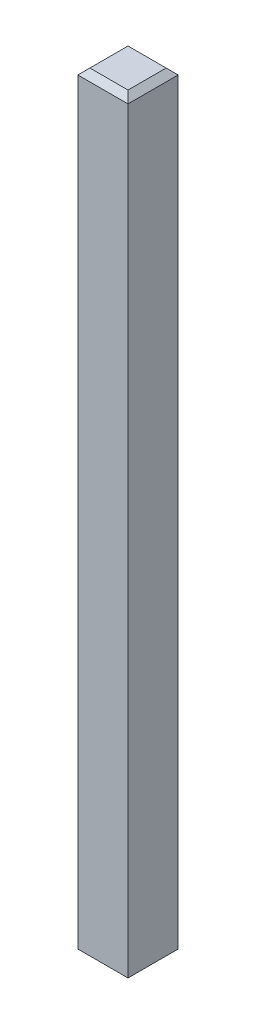
from build123d import *

# Parameters (mm, degrees)
SKETCH1_W           = 0.75
SKETCH1_H           = 0.75
BOSS_EXTRUDE1_DEPTH = 11.5
CHAMFER1_SIZE       = 0.09


with BuildPart() as part:
    # Sketch1 → Boss-Extrude1 (new body)
    with BuildSketch(Plane(origin=(0, 0, 0), x_dir=(1, 0, 0), z_dir=(0, 1, 0))):
        Rectangle(SKETCH1_W, SKETCH1_H)
    extrude(amount=BOSS_EXTRUDE1_DEPTH)

    # Chamfer1
    chamfer1_edges = [part.edges().sort_by_distance(p)[0] for p in [
        (-0.375, 11.5, 0),
        (0, 11.5, 0.375),
        (0.375, 11.5, 0),
        (0, 0, 0.375),
        (-0.375, 0, 0),
        (0, 0, -0.375),
        (0.375, 0, 0),
        (0, 11.5, -0.375),
    ]]
    chamfer(chamfer1_edges, length=CHAMFER1_SIZE)


solid = part.part
